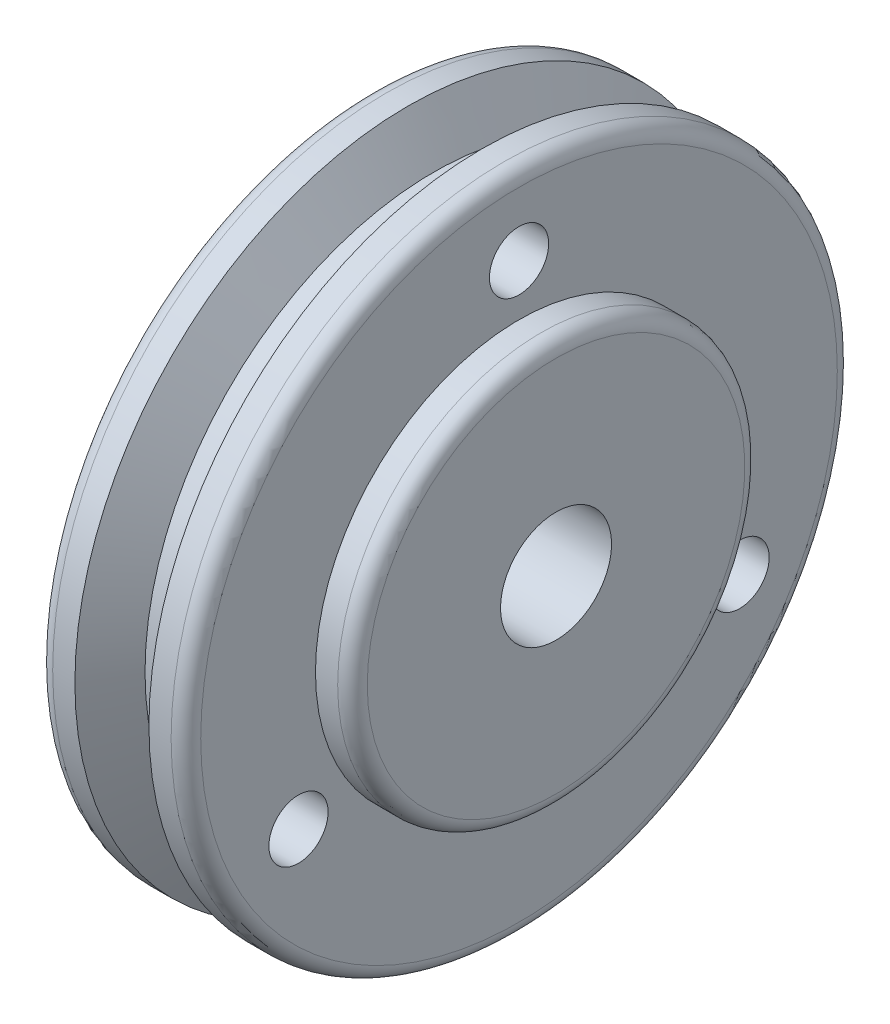
from build123d import *

# Parameters (mm, degrees)
IZIM2_R               = 4
KES_EKSTR_ZYON2_DEPTH = 74.116345765


with BuildPart() as part:
    # Çizim1 → Döndür2 (revolve)
    with BuildSketch(Plane.XY, mode=Mode.PRIVATE) as d_nd_r2_sk:
        with BuildLine():
            Line((-1.500885478, 45), (1.970188902, 39))
            Line((1.970188902, 39), (5.970188902, 39))
            Line((5.970188902, 39), (8.499114522, 45))
            Line((8.499114522, 45), (11.499114522, 45))
            ThreePointArc((11.499114522, 45), (12.913328084, 44.414213562), (13.499114522, 43))
            Line((13.499114522, 43), (13.499114522, 27.5))
            Line((13.499114522, 27.5), (16.499114522, 27.5))
            ThreePointArc((16.499114522, 27.5), (17.913328084, 26.914213562), (18.499114522, 25.5))
            Line((18.499114522, 25.5), (18.499114522, 20.020661157))
            Line((18.499114522, 20.020661157), (18.499114522, 7.5))
            Line((18.499114522, 7.5), (-22.500885478, 7.5))
            Line((-22.500885478, 7.5), (-22.500885478, 15.5))
            ThreePointArc((-22.500885478, 15.5), (-21.915099041, 16.914213562), (-20.500885478, 17.5))
            Line((-20.500885478, 17.5), (-6.500885478, 17.5))
            Line((-6.500885478, 17.5), (-6.500885478, 24.44214876))
            Line((-6.500885478, 24.44214876), (-6.500885478, 43))
            ThreePointArc((-6.500885478, 43), (-5.915099041, 44.414213562), (-4.500885478, 45))
            Line((-4.500885478, 45), (-1.500885478, 45))
        make_face()
    revolve(d_nd_r2_sk.sketch.rotate(Axis((-33.856257379, 0, 0), (1, 0, 0)), 90), axis=Axis((-33.856257379, 0, 0), (1, 0, 0)))

    # Çizim2 → Kes-Ekstrüzyon2 (cut, through all)
    with BuildSketch(Plane(origin=(13.499114522, 0, 0), x_dir=(0, 0, -1), z_dir=(1, 0, 0))):
        with Locations((0, 34.402169776)):
            Circle(IZIM2_R)
        with Locations((29.793152971, -17.201084888)):
            Circle(IZIM2_R)
        with Locations((-29.793152971, -17.201084888)):
            Circle(IZIM2_R)
    extrude(amount=-KES_EKSTR_ZYON2_DEPTH, mode=Mode.SUBTRACT)


solid = part.part
